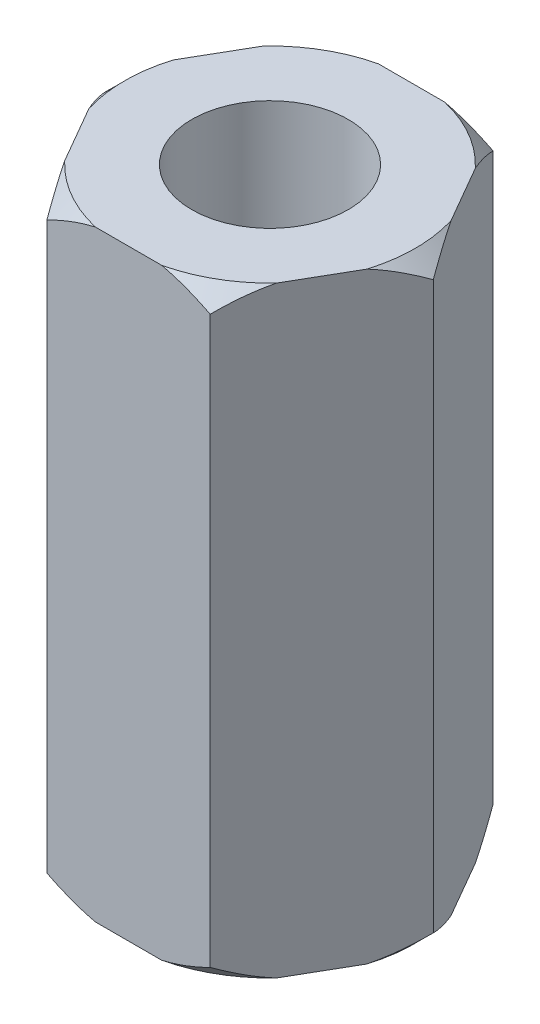
from build123d import *

# Parameters (mm, degrees)
SKETCH1_R           = 1.3
BOSS_EXTRUDE1_DEPTH = 10


with BuildPart() as part:
    # Sketch1 → Boss-Extrude1 (new body)
    with BuildSketch(Plane(origin=(0, 0, 0), x_dir=(1, 0, 0), z_dir=(0, 1, 0))):
        Polygon((-2.713546265, 0), (-1.356773133, -2.35), (1.356773133, -2.35), (2.713546265, 0), (1.356773133, 2.35), (-1.356773133, 2.35), align=None)
        with Locations(Location((0, 0, 0), (0, 0, 270))):
            Circle(SKETCH1_R, mode=Mode.SUBTRACT)
    extrude(amount=BOSS_EXTRUDE1_DEPTH)

    # Sketch6 → Cut-Revolve1 (revolve, cut)
    with BuildSketch(Plane.XY):
        Polygon((-2.713546265, 10), (-2.713546265, 9.7), (-2.413546265, 10), align=None)
        Polygon((-2.413546265, 0), (-2.713546265, 0), (-2.713546265, 0.3), align=None)
    revolve(axis=Axis((0, 0, 0), (0, 1, 0)), mode=Mode.SUBTRACT)


solid = part.part
